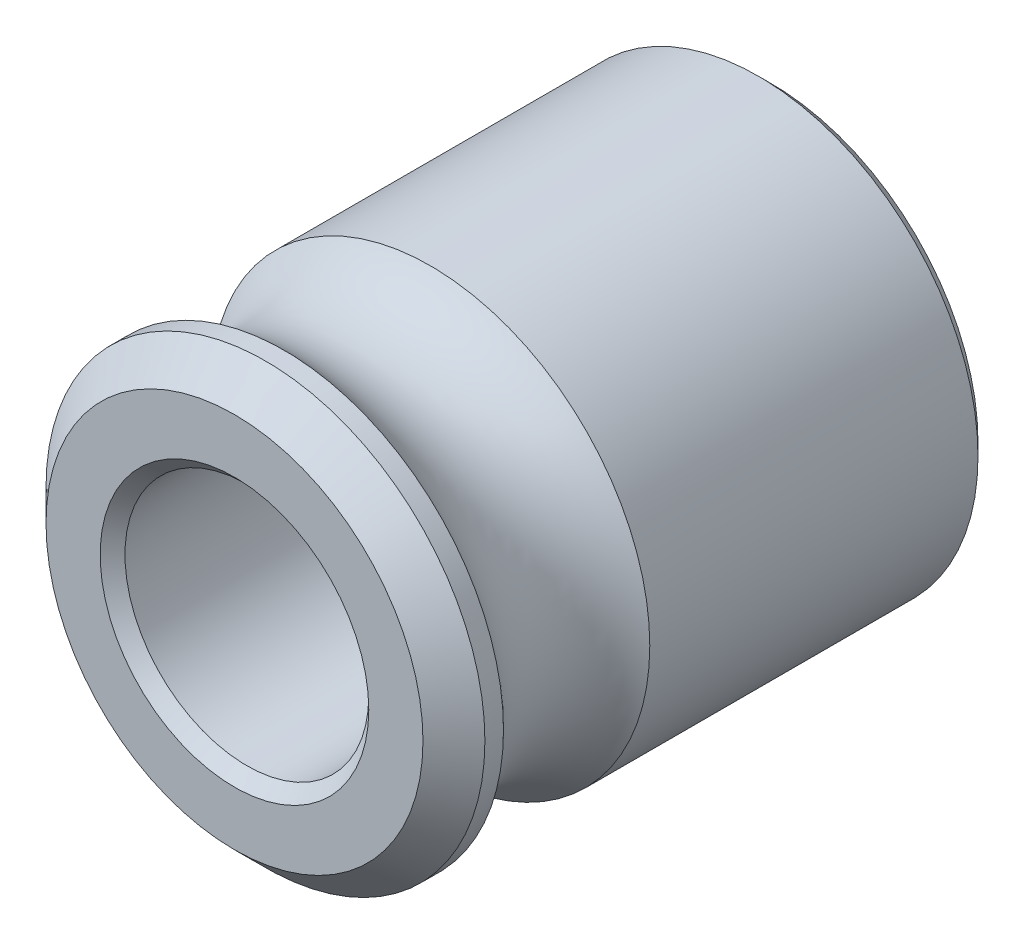
from build123d import *

# Parameters (mm, degrees)
SKETCH1_R           = 4.5
SKETCH1_R_2         = 2.5
BOSS_EXTRUDE1_DEPTH = 11
SKETCH2_R           = 2
CHAMFER1_SIZE       = 0.635
CHAMFER2_SIZE       = 0.254


with BuildPart() as part:
    # Sketch1 → Boss-Extrude1 (new body)
    with BuildSketch(Plane.XY):
        Circle(SKETCH1_R)
        Circle(SKETCH1_R_2, mode=Mode.SUBTRACT)
    extrude(amount=BOSS_EXTRUDE1_DEPTH)

    # Sketch2 → Cut-Revolve1 (revolve, cut)
    with BuildSketch(Plane(origin=(0, 0, 0), x_dir=(-1, 0, 0), z_dir=(0, -1, 0)), mode=Mode.PRIVATE) as cut_revolve1_sk:
        with Locations((5.822875656, -8.484)):
            Circle(SKETCH2_R)
    revolve(cut_revolve1_sk.sketch.rotate(Axis((0, 0, 11), (0, 0, -1)), 180), axis=Axis((0, 0, 11), (0, 0, -1)), mode=Mode.SUBTRACT)

    # Chamfer1
    chamfer1_edges = [part.edges().sort_by_distance(p)[0] for p in [
        (-4.5, 0, 11),
    ]]
    chamfer(chamfer1_edges, length=CHAMFER1_SIZE)

    # Chamfer2
    chamfer2_edges = [part.edges().sort_by_distance(p)[0] for p in [
        (-4.5, 0, 0),
        (-2.5, 0, 0),
        (-2.5, 0, 11),
    ]]
    chamfer(chamfer2_edges, length=CHAMFER2_SIZE)


solid = part.part
